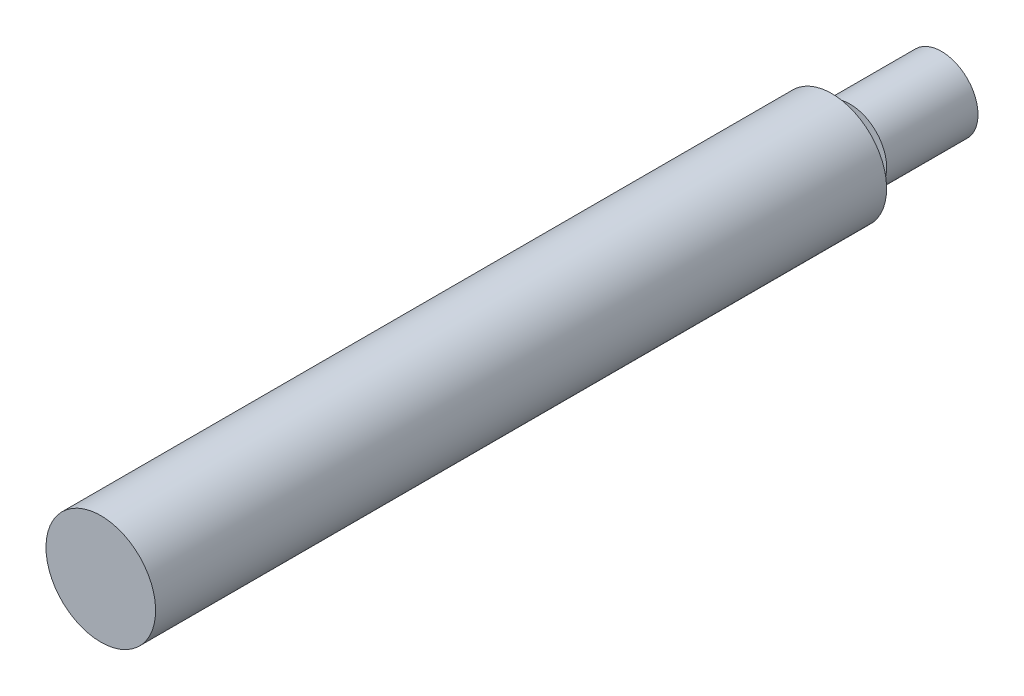
from build123d import *


with BuildPart() as part:
    # Sketch1 → Revolve1 (revolve)
    with BuildSketch(Plane.XZ, mode=Mode.PRIVATE) as revolve1_sk:
        Polygon((0, 40), (3, 40), (3, 0), (1.5, 0), (1.5, -1), (2, -1), (2, -6), (0, -6), align=None)
    revolve(revolve1_sk.sketch.rotate(Axis((0, 0, 44.681241357), (0, 0, -1)), 90), axis=Axis((0, 0, 44.681241357), (0, 0, -1)))


solid = part.part
